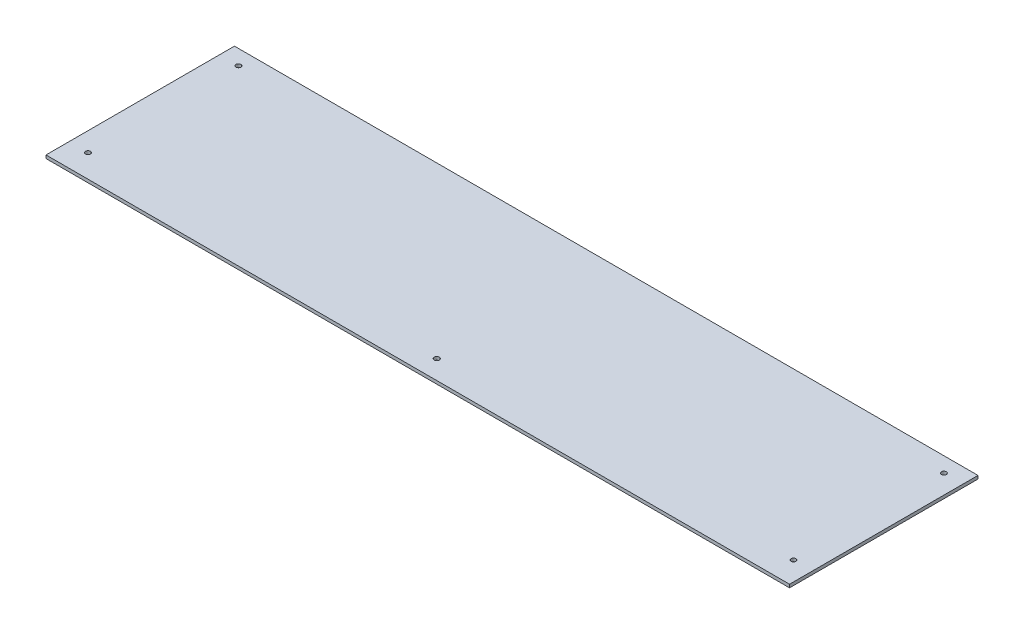
from build123d import *

# Parameters (mm, degrees)
CROQUIS1_W              = 470.5
CROQUIS1_H              = 120
CROQUIS1_R              = 1.55
SALIENTE_EXTRUIR1_DEPTH = 2
CROQUIS2_W              = 470.5
CROQUIS2_H              = 120
CROQUIS2_W_2            = 469.5
CROQUIS2_H_2            = 119
CORTAR_EXTRUIR1_DEPTH   = 2
CROQUIS3_R              = 1.6
CORTAR_EXTRUIR2_DEPTH   = 2


with BuildPart() as part:
    # Croquis1 → Saliente-Extruir1 (new body)
    with BuildSketch(Plane(origin=(0, 0, 0), x_dir=(1, 0, 0), z_dir=(0, 1, 0))):
        with Locations((235.25, 60)):
            Rectangle(CROQUIS1_W, CROQUIS1_H)
        with Locations(Location((12.5, 15, 0), (0, 0, 270))):
            Circle(CROQUIS1_R, mode=Mode.SUBTRACT)
        with Locations(Location((12.5, 110, 0), (0, 0, 270))):
            Circle(CROQUIS1_R, mode=Mode.SUBTRACT)
        with Locations(Location((458, 15, 0), (0, 0, 90))):
            Circle(CROQUIS1_R, mode=Mode.SUBTRACT)
        with Locations(Location((458, 110, 0), (0, 0, 90))):
            Circle(CROQUIS1_R, mode=Mode.SUBTRACT)
    extrude(amount=SALIENTE_EXTRUIR1_DEPTH)

    # Croquis2 → Cortar-Extruir1 (cut)
    with BuildSketch(Plane.XZ):
        with Locations((235.25, -60)):
            Rectangle(CROQUIS2_W, CROQUIS2_H)
        with Locations((235.25, -60)):
            Rectangle(CROQUIS2_W_2, CROQUIS2_H_2, mode=Mode.SUBTRACT)
    extrude(amount=-CORTAR_EXTRUIR1_DEPTH, mode=Mode.SUBTRACT)

    # Croquis3 → Cortar-Extruir2 (cut)
    with BuildSketch(Plane.XZ):
        with Locations(Location((235.25, -12.5, 0), (0, 0, 270))):
            Circle(CROQUIS3_R)
    extrude(amount=-CORTAR_EXTRUIR2_DEPTH, mode=Mode.SUBTRACT)


solid = part.part
